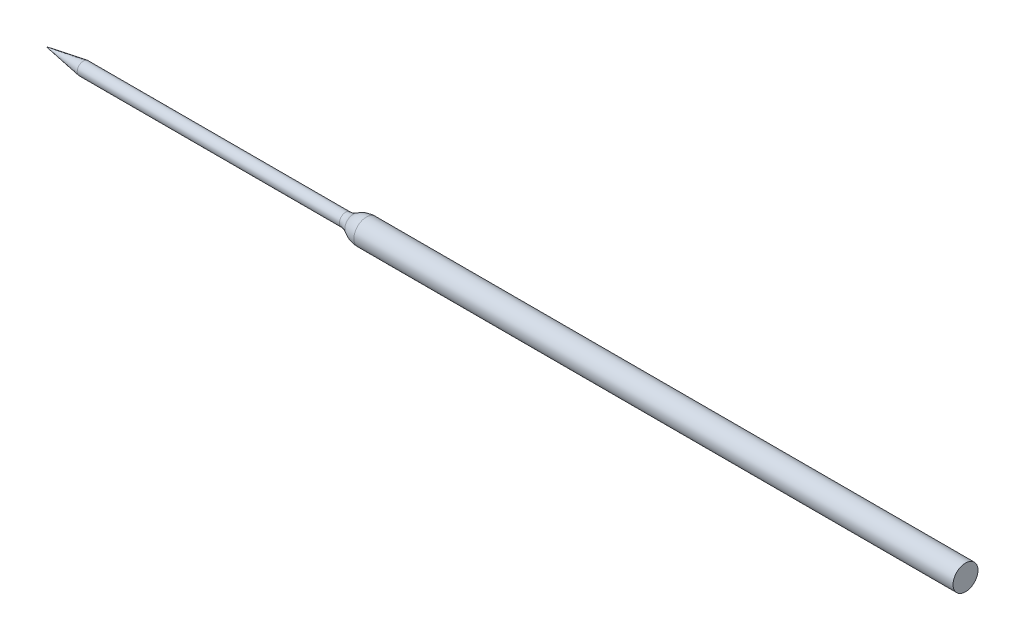
from build123d import *


with BuildPart() as part:
    # Sketch1 → Revolve1 (revolve)
    with BuildSketch(Plane.XY, mode=Mode.PRIVATE) as revolve1_sk:
        with BuildLine():
            Line((0, 0), (4.7625, 0.79375))
            Line((4.7625, 0.79375), (38.1, 0.79375))
            ThreePointArc((38.1, 0.79375), (38.618634231, 0.870011143), (39.093363314, 1.092338661))
            ThreePointArc((39.093363314, 1.092338661), (39.880625254, 1.461033142), (40.740696831, 1.5875))
            Line((40.740696831, 1.5875), (116.940696831, 1.5875))
            Line((116.940696831, 1.5875), (116.940696831, 0))
            Line((116.940696831, 0), (0, 0))
        make_face()
    revolve(revolve1_sk.sketch.rotate(Axis((0, 0, 0), (1, 0, 0)), 180), axis=Axis((0, 0, 0), (1, 0, 0)))


solid = part.part
